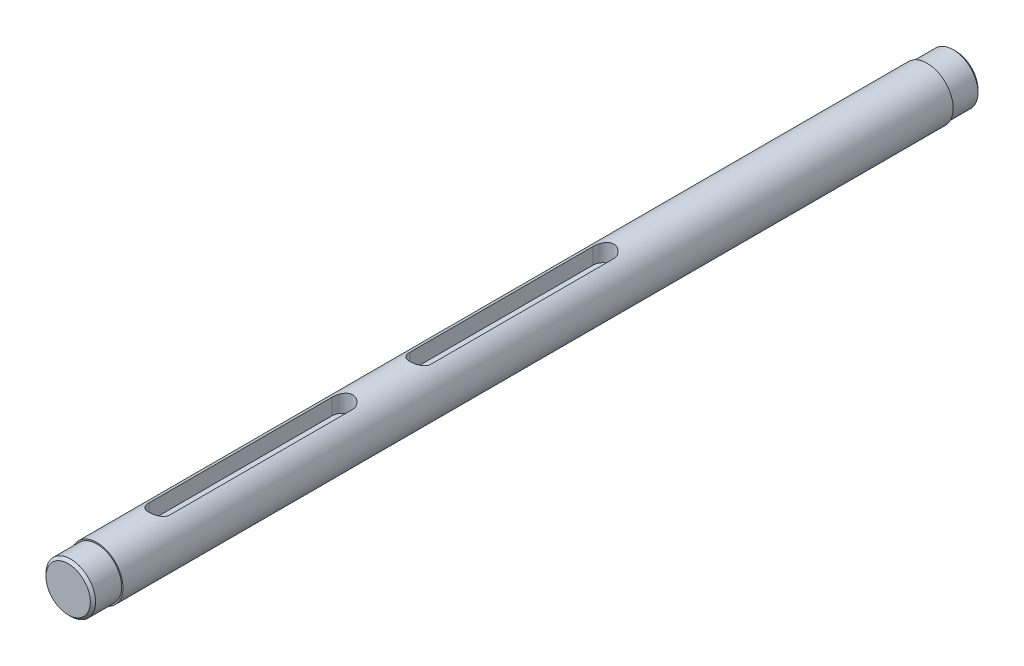
from build123d import *

# Parameters (mm, degrees)
CROQUIS1_R              = 5
SALIENTE_EXTRUIR1_DEPTH = 170
CORTAR_EXTRUIR1_START   = -5.5
CROQUIS2_R              = 5
CROQUIS2_R_2            = 4.75
CORTAR_EXTRUIR1_DEPTH   = 5.5
CROQUIS3_R              = 5
CROQUIS3_R_2            = 4.75
CORTAR_EXTRUIR2_DEPTH   = 5.5
CHAFL_N1_SIZE           = 0.5
CORTAR_EXTRUIR4_DEPTH   = 3.5


with BuildPart() as part:
    # Croquis1 → Saliente-Extruir1 (new body)
    with BuildSketch(Plane.XY):
        Circle(CROQUIS1_R)
    extrude(amount=SALIENTE_EXTRUIR1_DEPTH)

    # Croquis2 → Cortar-Extruir1 (cut)
    with BuildSketch(Plane.XY.offset(170).offset(CORTAR_EXTRUIR1_START)):
        Circle(CROQUIS2_R)
        Circle(CROQUIS2_R_2, mode=Mode.SUBTRACT)
    extrude(amount=CORTAR_EXTRUIR1_DEPTH, mode=Mode.SUBTRACT)

    # Croquis3 → Cortar-Extruir2 (cut)
    with BuildSketch(Plane(origin=(0, 0, 0), x_dir=(-1, 0, 0), z_dir=(0, 0, -1))):
        Circle(CROQUIS3_R)
        with Locations(Location((0, 0, 0), (0, 0, 180))):
            Circle(CROQUIS3_R_2, mode=Mode.SUBTRACT)
    extrude(amount=-CORTAR_EXTRUIR2_DEPTH, mode=Mode.SUBTRACT)

    # Chaflán1
    chafl_n1_edges = [part.edges().sort_by_distance(p)[0] for p in [
        (-4.75, 0, 0),
        (-4.75, 0, 170),
    ]]
    chamfer(chafl_n1_edges, length=CHAFL_N1_SIZE)

    # Croquis4 → Cortar-Extruir4 (cut)
    with BuildSketch(Plane(origin=(0, 5, 0), x_dir=(-1, 0, 0), z_dir=(0, -1, 0))):
        with BuildLine():
            Line((2, -117.5), (2, -152.5))
            ThreePointArc((2, -152.5), (0, -154.5), (-2, -152.5))
            Line((-2, -152.5), (-2, -117.5))
            ThreePointArc((-2, -117.5), (0, -115.5), (2, -117.5))
        make_face()
        with BuildLine():
            Line((-2, -102.5), (-2, -67.5))
            ThreePointArc((-2, -67.5), (0, -65.5), (2, -67.5))
            Line((2, -67.5), (2, -102.5))
            ThreePointArc((2, -102.5), (0, -104.5), (-2, -102.5))
        make_face()
    extrude(amount=CORTAR_EXTRUIR4_DEPTH, mode=Mode.SUBTRACT)


solid = part.part
